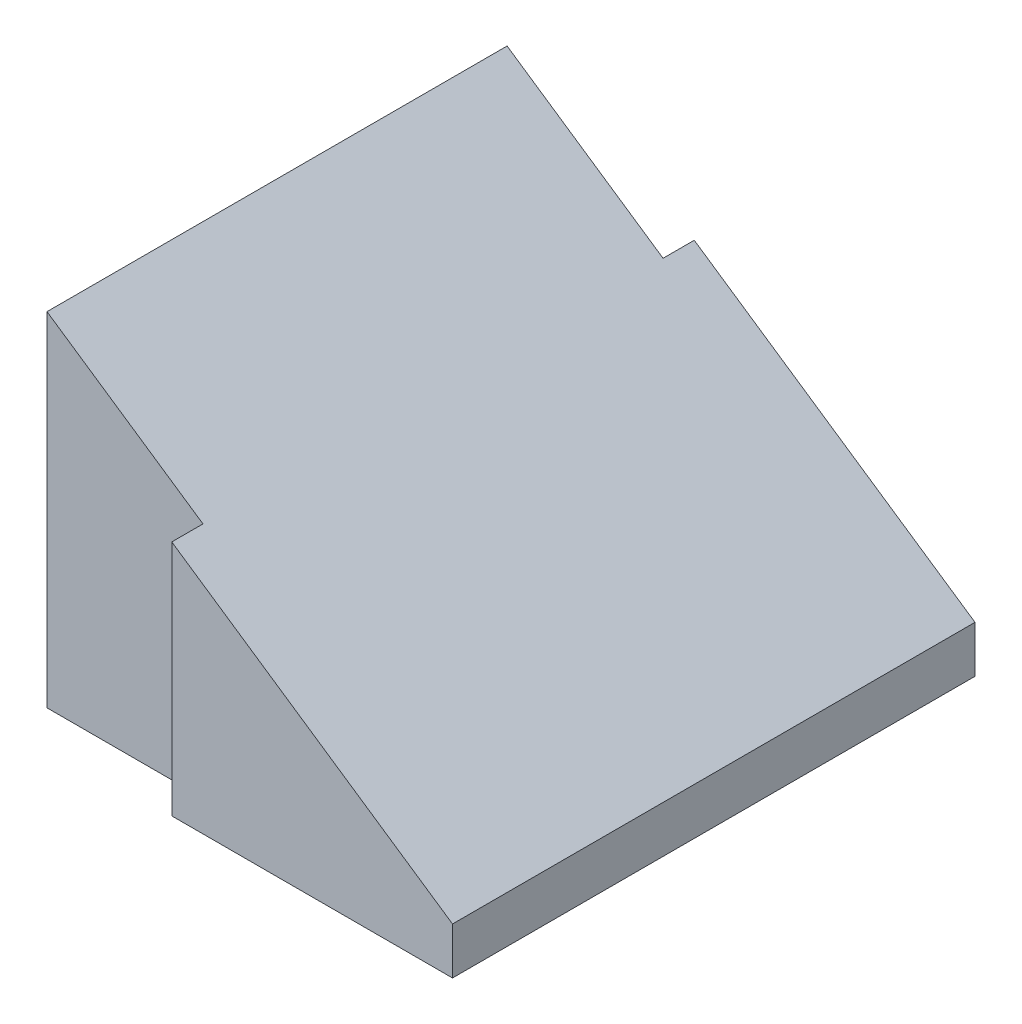
from build123d import *

# Parameters (mm, degrees)
SKETCH1_W           = 28
SKETCH1_H           = 33.5
BOSS_EXTRUDE1_DEPTH = 22
CUT_EXTRUDE1_DEPTH  = 44
SKETCH4_W           = 10
SKETCH4_H           = 2
CUT_EXTRUDE3_DEPTH  = 49


with BuildPart() as part:
    # Sketch1 → Boss-Extrude1 (new body)
    with BuildSketch(Plane(origin=(0, 0, 0), x_dir=(1, 0, 0), z_dir=(0, 1, 0))):
        Rectangle(SKETCH1_W, SKETCH1_H)
    extrude(amount=BOSS_EXTRUDE1_DEPTH)

    # Sketch3 → Cut-Extrude1 (cut)
    with BuildSketch(Plane.XY.offset(16.75)):
        Polygon((14, 22), (-14, 22), (14, 3), align=None)
    extrude(amount=-CUT_EXTRUDE1_DEPTH, mode=Mode.SUBTRACT)

    # Sketch4 → Cut-Extrude3 (cut)
    with BuildSketch(Plane.XZ):
        with Locations((-9, 15.75)):
            Rectangle(SKETCH4_W, SKETCH4_H)
        with Locations((-9, -15.75)):
            Rectangle(SKETCH4_W, SKETCH4_H)
    extrude(amount=-CUT_EXTRUDE3_DEPTH, mode=Mode.SUBTRACT)


solid = part.part
